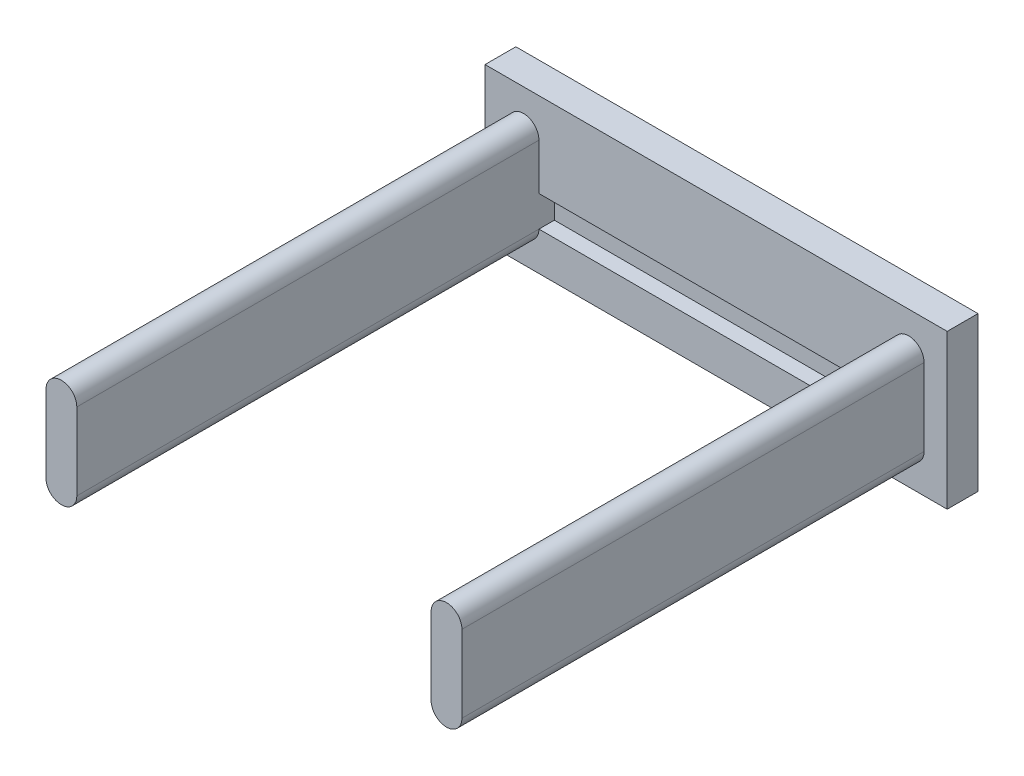
from build123d import *

# Parameters (mm, degrees)
CROQUIS1_W              = 30
CROQUIS1_H              = 10
SALIENTE_EXTRUIR1_DEPTH = 2
SALIENTE_EXTRUIR2_DEPTH = 20
CROQUIS3_W              = 23
CROQUIS3_H              = 2
CORTAR_EXTRUIR1_DEPTH   = 1
SALIENTE_EXTRUIR3_DEPTH = 10


with BuildPart() as part:
    # Croquis1 → Saliente-Extruir1 (new body)
    with BuildSketch(Plane.XY):
        Rectangle(CROQUIS1_W, CROQUIS1_H)
    extrude(amount=SALIENTE_EXTRUIR1_DEPTH)

    # Croquis2 → Saliente-Extruir2 (add)
    with BuildSketch(Plane.XY.offset(2)):
        with BuildLine():
            Line((-13.5, -2.5), (-13.5, 2.5))
            ThreePointArc((-13.5, 2.5), (-12.5, 3.5), (-11.5, 2.5))
            Line((-11.5, 2.5), (-11.5, -2.5))
            ThreePointArc((-11.5, -2.5), (-12.5, -3.5), (-13.5, -2.5))
        make_face()
        with BuildLine():
            Line((11.5, 2.5), (11.5, -2.5))
            ThreePointArc((11.5, -2.5), (12.5, -3.5), (13.5, -2.5))
            Line((13.5, -2.5), (13.5, 2.5))
            ThreePointArc((13.5, 2.5), (12.5, 3.5), (11.5, 2.5))
        make_face()
    extrude(amount=SALIENTE_EXTRUIR2_DEPTH)

    # Croquis3 → Cortar-Extruir1 (cut)
    with BuildSketch(Plane.XY.offset(2)):
        with Locations((0, -1.5)):
            Rectangle(CROQUIS3_W, CROQUIS3_H)
    extrude(amount=-CORTAR_EXTRUIR1_DEPTH, mode=Mode.SUBTRACT)

    # Croquis4 → Saliente-Extruir3 (add)
    with BuildSketch(Plane.XY.offset(22)):
        with BuildLine():
            Line((-13.5, 2.5), (-11.5, 2.5))
            ThreePointArc((-11.5, 2.5), (-12.5, 3.5), (-13.5, 2.5))
        make_face()
        with BuildLine():
            ThreePointArc((-11.5, 2.5), (-12.5, 3.5), (-13.5, 2.5))
            Line((-13.5, 2.5), (-11.5, 2.5))
        make_face()
        with BuildLine():
            Line((-11.5, 2.5), (-13.5, 2.5))
            ThreePointArc((-13.5, 2.5), (-12.5, 1.5), (-11.5, 2.5))
        make_face()
        with BuildLine():
            ThreePointArc((-11.5, 2.5), (-12.5, 1.5), (-13.5, 2.5))
            Line((-13.5, 2.5), (-13.5, -2.5))
            ThreePointArc((-13.5, -2.5), (-12.5, -1.5), (-11.5, -2.5))
            Line((-11.5, -2.5), (-11.5, 2.5))
        make_face()
        with BuildLine():
            Line((-13.5, -2.5), (-11.5, -2.5))
            ThreePointArc((-11.5, -2.5), (-12.5, -3.5), (-13.5, -2.5))
        make_face()
        with BuildLine():
            ThreePointArc((-11.5, -2.5), (-12.5, -1.5), (-13.5, -2.5))
            Line((-13.5, -2.5), (-11.5, -2.5))
        make_face()
        with BuildLine():
            Line((-11.5, -2.5), (-13.5, -2.5))
            ThreePointArc((-13.5, -2.5), (-12.5, -3.5), (-11.5, -2.5))
        make_face()
        with BuildLine():
            ThreePointArc((13.5, -2.5), (12.5, -1.5), (11.5, -2.5))
            Line((11.5, -2.5), (13.5, -2.5))
        make_face()
        with BuildLine():
            Line((13.5, -2.5), (11.5, -2.5))
            ThreePointArc((11.5, -2.5), (12.5, -3.5), (13.5, -2.5))
        make_face()
        with BuildLine():
            ThreePointArc((13.5, 2.5), (12.5, 1.5), (11.5, 2.5))
            Line((11.5, 2.5), (11.5, -2.5))
            ThreePointArc((11.5, -2.5), (12.5, -1.5), (13.5, -2.5))
            Line((13.5, -2.5), (13.5, 2.5))
        make_face()
        with BuildLine():
            ThreePointArc((13.5, 2.5), (12.5, 3.5), (11.5, 2.5))
            Line((11.5, 2.5), (13.5, 2.5))
        make_face()
        with BuildLine():
            Line((13.5, 2.5), (11.5, 2.5))
            ThreePointArc((11.5, 2.5), (12.5, 1.5), (13.5, 2.5))
        make_face()
    extrude(amount=SALIENTE_EXTRUIR3_DEPTH)


solid = part.part
